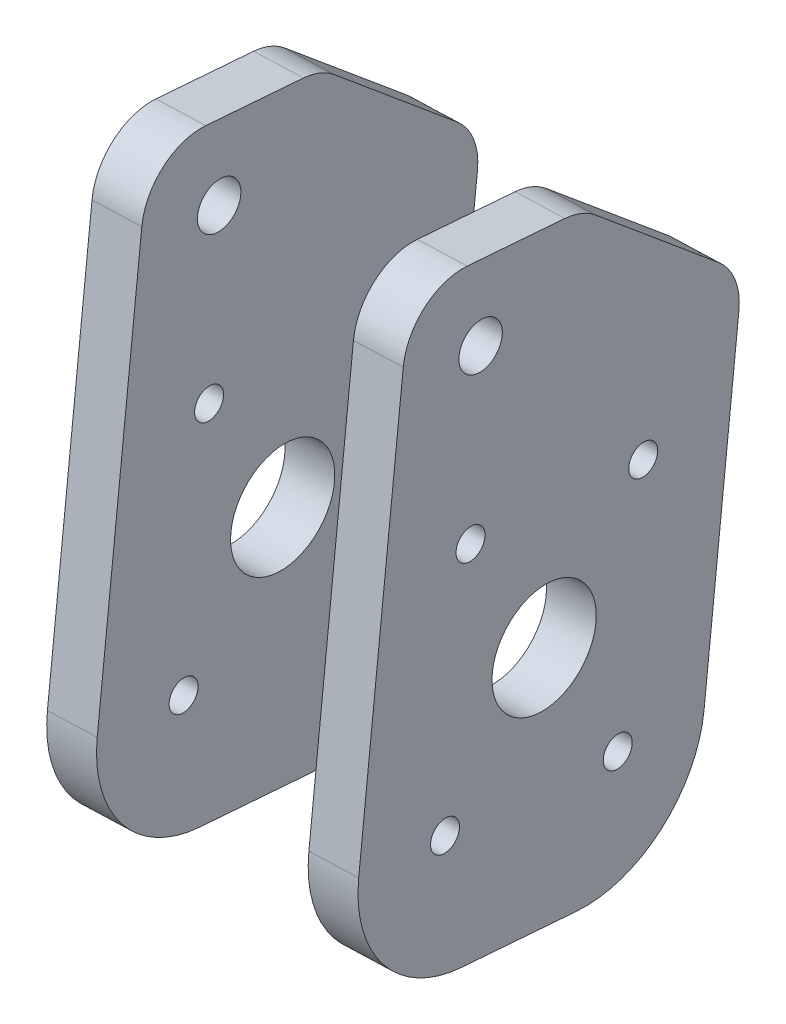
from build123d import *

# Parameters (mm, degrees)
SKETCH2_R               = 4.7625
SKETCH2_R_2             = 3.175
SKETCH2_R_3             = 11.43
BOSS_EXTRUDE1_DEPTH     = 31.75
FILLET1_R               = 25.4
FILLET3_R               = 12.7
CUT_EXTRUDE1_DEPTH      = 2420.162449584
CUT_EXTRUDE1_DEPTH_BACK = 2420.162449584


with BuildPart() as part:
    # Sketch2 → Boss-Extrude1 (new, symmetric)
    with BuildSketch(Plane(origin=(2275.719022847, 0, -81.853759117), x_dir=(0.02419992607999972, -0.7394171395677195, 0.6728124978708514), z_dir=(-0.9993537674319818, 0, 0.03594506251913508))):
        Polygon((137.38245748, 763.046514622), (34.646501725, 837.707906218), (12.248084246, 806.887119491), (10.396857918, 761.134054446), (92.585622522, 701.404941169), align=None)
        with Locations((37.11326636, 814.409603855)):
            Circle(SKETCH2_R, mode=Mode.SUBTRACT)
        with Locations((64.541675287, 792.432956216)):
            Circle(SKETCH2_R_2, mode=Mode.SUBTRACT)
        with Locations((105.636057589, 762.568399578)):
            Circle(SKETCH2_R_2, mode=Mode.SUBTRACT)
        with Locations((83.237640111, 731.747612851)):
            Circle(SKETCH2_R_2, mode=Mode.SUBTRACT)
        with Locations((42.143257808, 761.61216949)):
            Circle(SKETCH2_R_2, mode=Mode.SUBTRACT)
        with Locations((73.889657699, 762.090284534)):
            Circle(SKETCH2_R_3, mode=Mode.SUBTRACT)
    extrude(amount=BOSS_EXTRUDE1_DEPTH, both=True)

    # Fillet1
    fillet1_edges = [part.edges().sort_by_distance(p)[0] for p in [
        (2296.601805866, 403.759777726, 498.73468398),
        (2299.324220067, 412.136269845, 574.423935798),
    ]]
    fillet(fillet1_edges, radius=FILLET1_R)

    # Fillet3
    fillet3_edges = [part.edges().sort_by_distance(p)[0] for p in [
        (2296.200347822, 504.744039468, 487.573245371),
        (2297.461190412, 534.178350963, 522.627511627),
        (2298.822397513, 538.366597022, 560.472137536),
    ]]
    fillet(fillet3_edges, radius=FILLET3_R)

    # Sketch3 → Cut-Extrude1 (cut, two sides: drawn at the far end of the back side and taken through both)
    with BuildSketch(Plane(origin=(-1.333381219, 335.403711787, -37.071003677), x_dir=(0.9999921696711004, 0.00395135039134013, -0.000217776422413385), z_dir=(0.003951358699527253, -0.9939395840765799, 0.10985667922390137)).offset(-CUT_EXTRUDE1_DEPTH_BACK)):
        Polygon((2276.494558522, 540.348010985), (2319.646654317, 538.795906449), (2322.385662322, 614.946663734), (2279.233566526, 616.498768271), align=None)
    extrude(amount=CUT_EXTRUDE1_DEPTH + CUT_EXTRUDE1_DEPTH_BACK, mode=Mode.SUBTRACT)


with BuildPart() as cut_extrude1_piece_1:
    # of the separate pieces the step leaves, piece 1, a body of its own (cut_extrude1_pieces)
    add(part.part.solids().sort_by_distance((2330.602061884, 525.743564305, 560.726061627))[0])


with BuildPart() as cut_extrude1_piece_2:
    # of the separate pieces the step leaves, piece 2, a body of its own (cut_extrude1_pieces)
    add(part.part.solids().sort_by_distance((2277.647807718, 437.38233528, 572.409630045))[0])


solid = Compound([cut_extrude1_piece_1.part, cut_extrude1_piece_2.part])
